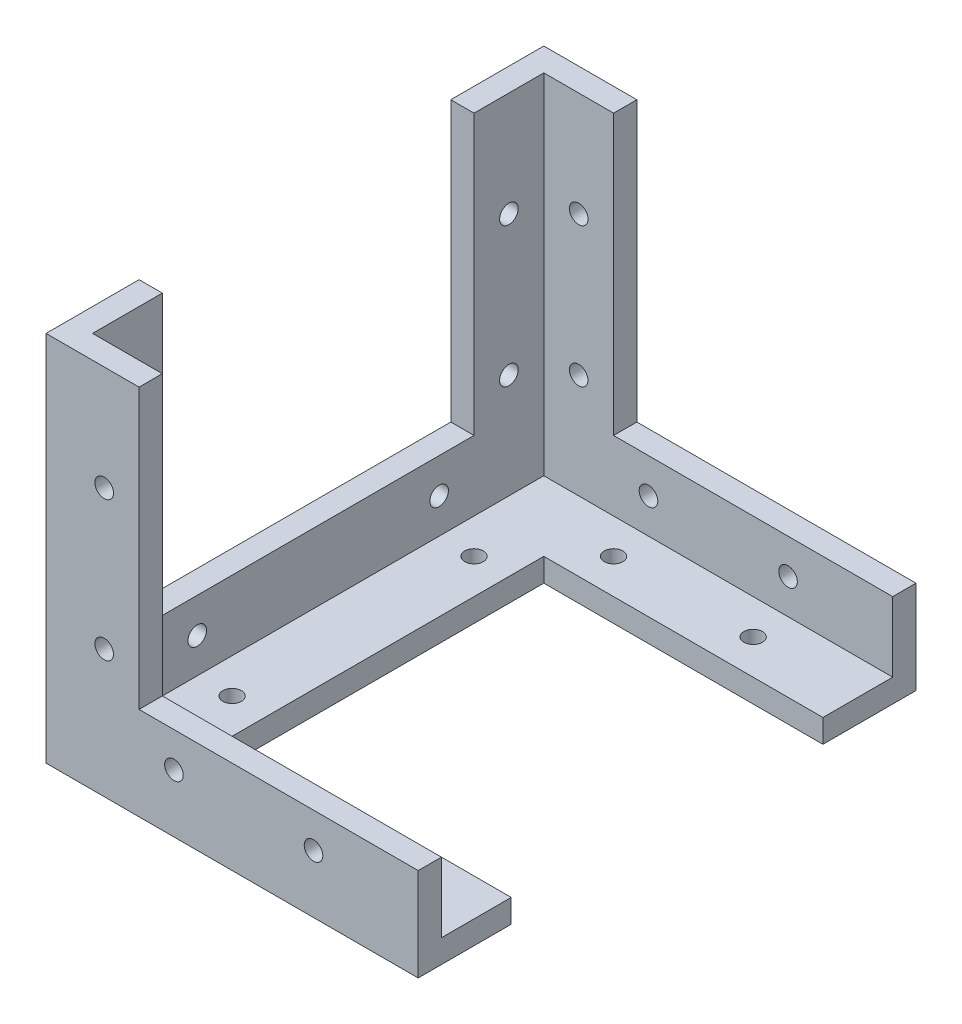
from build123d import *

# Parameters (mm, degrees)
BOSS_EXTRUDE1_DEPTH             = 5
BOSS_EXTRUDE2_DEPTH             = 5
BOSS_EXTRUDE3_DEPTH             = 5
HIEGHT_EXTENSION_DEPTH          = 27
BOSS_EXTRUDE6_DEPTH             = 5
SKETCH7_W                       = 20
SKETCH7_H                       = 80
BOSS_EXTRUDE7_DEPTH             = 5
SKETCH8_W                       = 80
SKETCH8_H                       = 20
BOSS_EXTRUDE8_DEPTH             = 5
F_4_0MM_DOWEL_HOLE1_D           = 4
F_4_0MM_DOWEL_HOLE1_ON_FACE_2_D = 4
F_4_0MM_DOWEL_HOLE1_ON_FACE_3_D = 4
F_4_0MM_DOWEL_HOLE1_ON_FACE_4_D = 4


with BuildPart() as part:
    # Sketch1 → Boss-Extrude1 (new body)
    with BuildSketch(Plane(origin=(0, 0, 0), x_dir=(1, 0, 0), z_dir=(0, 1, 0))):
        Polygon((-20, 20), (-20, -60), (0, -60), (0, 0), (60, 0), (60, 20), align=None)
    extrude(amount=-BOSS_EXTRUDE1_DEPTH)

    # Sketch2 → Boss-Extrude2 (add)
    with BuildSketch(Plane.ZY.offset(20)):
        Polygon((-20, -5), (60, -5), (60, 15), (0, 15), (0, 75), (-20, 75), align=None)
    extrude(amount=-BOSS_EXTRUDE2_DEPTH)

    # Sketch3 → Boss-Extrude3 (add)
    with BuildSketch(Plane(origin=(0, 0, -20), x_dir=(-1, 0, 0), z_dir=(0, 0, -1))):
        Polygon((-60, -5), (20, -5), (20, 75), (0, 75), (0, 15), (-60, 15), align=None)
    extrude(amount=-BOSS_EXTRUDE3_DEPTH)

    # Sketch5 → hieght extension (add)
    with BuildSketch(Plane.XY.offset(60)):
        Polygon((0, 0), (-15, 0), (-15, 15), (-20, 15), (-20, -5), (0, -5), align=None)
    extrude(amount=HIEGHT_EXTENSION_DEPTH)

    # Sketch6 → Boss-Extrude6 (add)
    with BuildSketch(Plane.XY.offset(87)):
        Polygon((-20, 75), (-20, -5), (60, -5), (60, 15), (0, 15), (0, 75), align=None)
    extrude(amount=-BOSS_EXTRUDE6_DEPTH)

    # Sketch7 → Boss-Extrude7 (add)
    with BuildSketch(Plane.ZY.offset(20)):
        with Locations((77, 35)):
            Rectangle(SKETCH7_W, SKETCH7_H)
    extrude(amount=-BOSS_EXTRUDE7_DEPTH)

    # Sketch8 → Boss-Extrude8 (add)
    with BuildSketch(Plane.XZ.offset(5)):
        with Locations((20, 77)):
            Rectangle(SKETCH8_W, SKETCH8_H)
    extrude(amount=-BOSS_EXTRUDE8_DEPTH)

    # Ø4.0mm Dowel Hole1 (through all)
    with Locations(Plane(origin=(-15, 52.5, 74.5), x_dir=(0, 0, 1), z_dir=(1, 0, 0))):
        with Locations((0, 0), (0, 30), (-67, 45), (-15, 45), (-82, 30), (-82, 0)):
            Hole(F_4_0MM_DOWEL_HOLE1_D / 2)

    # Ø4.0mm Dowel Hole1 on face 2 (through all)
    with Locations(Plane(origin=(7.5, 0, 74.5), x_dir=(0, 0, 1), z_dir=(0, 1, 0))):
        with Locations((0, 0), (0, 30), (-67, -15), (-15, -15), (-82, 0), (-82, 30)):
            Hole(F_4_0MM_DOWEL_HOLE1_ON_FACE_2_D / 2)

    # Ø4.0mm Dowel Hole1 on face 3 (through all)
    with Locations(Plane(origin=(-7.5, 52.5, 82), x_dir=(-1, 0, 0), z_dir=(0, 0, -1))):
        with Locations((0, 0), (0, -30), (-15, -45), (-45, -45)):
            Hole(F_4_0MM_DOWEL_HOLE1_ON_FACE_3_D / 2)

    # Ø4.0mm Dowel Hole1 on face 4 (through all)
    with Locations(Plane(origin=(37.5, 7.5, -15), x_dir=(1, 0, 0), z_dir=(0, 0, 1))):
        with Locations((0, 0), (-30, 0), (-45, 15), (-45, 45)):
            Hole(F_4_0MM_DOWEL_HOLE1_ON_FACE_4_D / 2)


solid = part.part
